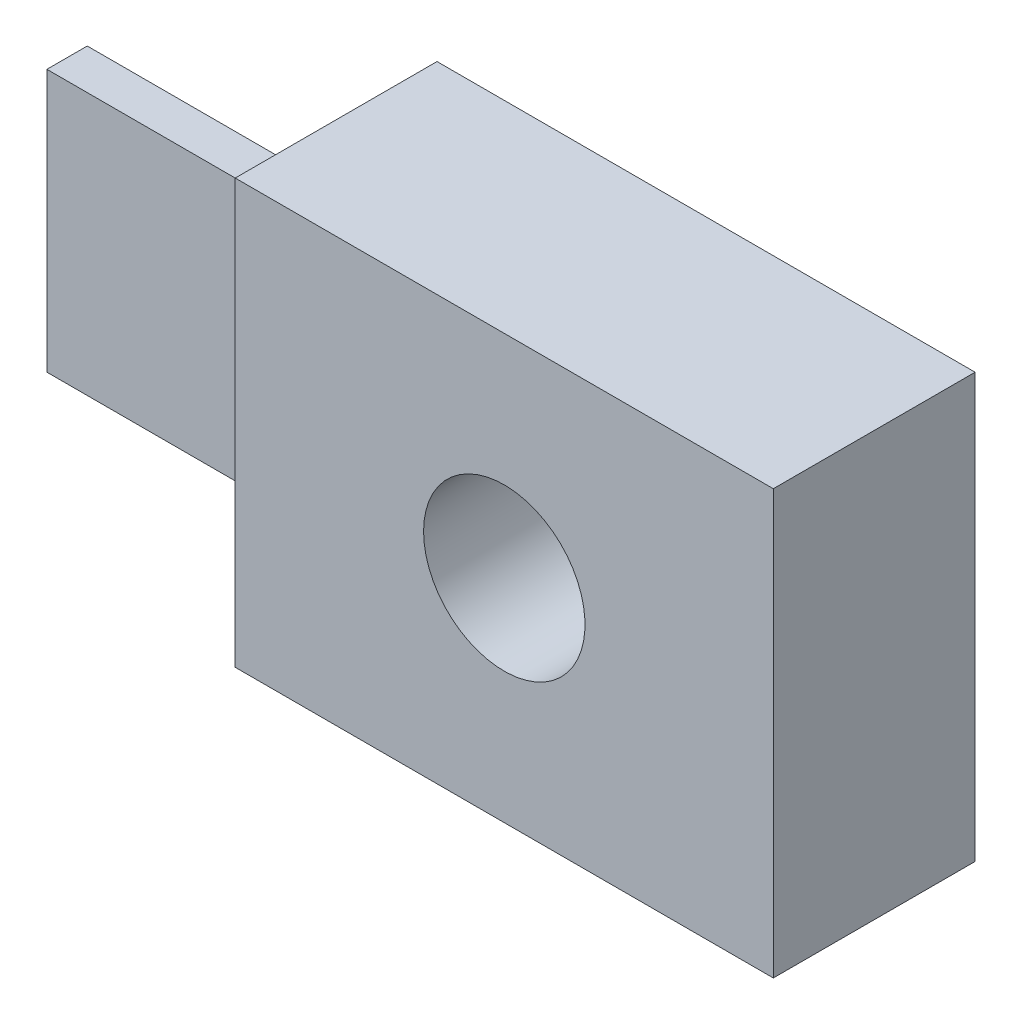
from build123d import *

# Parameters (mm, degrees)
SKETCH1_W           = 40
SKETCH1_H           = 31.5
BOSS_EXTRUDE1_DEPTH = 15
SKETCH2_W           = 3
SKETCH2_H           = 19.5
BOSS_EXTRUDE2_DEPTH = 20
SKETCH3_R           = 6
CUT_EXTRUDE1_DEPTH  = 46.530896104


with BuildPart() as part:
    # Sketch1 → Boss-Extrude1 (new body)
    with BuildSketch(Plane.XY):
        Rectangle(SKETCH1_W, SKETCH1_H)
    extrude(amount=BOSS_EXTRUDE1_DEPTH)

    # Sketch2 → Boss-Extrude2 (add)
    with BuildSketch(Plane.ZY.offset(20)):
        with Locations((7.5, 0)):
            Rectangle(SKETCH2_W, SKETCH2_H)
    extrude(amount=BOSS_EXTRUDE2_DEPTH)

    # Sketch3 → Cut-Extrude1 (cut, through all)
    with BuildSketch(Plane(origin=(0, 0, 0), x_dir=(-1, 0, 0), z_dir=(0, 0, -1))):
        Circle(SKETCH3_R)
    extrude(amount=-CUT_EXTRUDE1_DEPTH, mode=Mode.SUBTRACT)


solid = part.part
